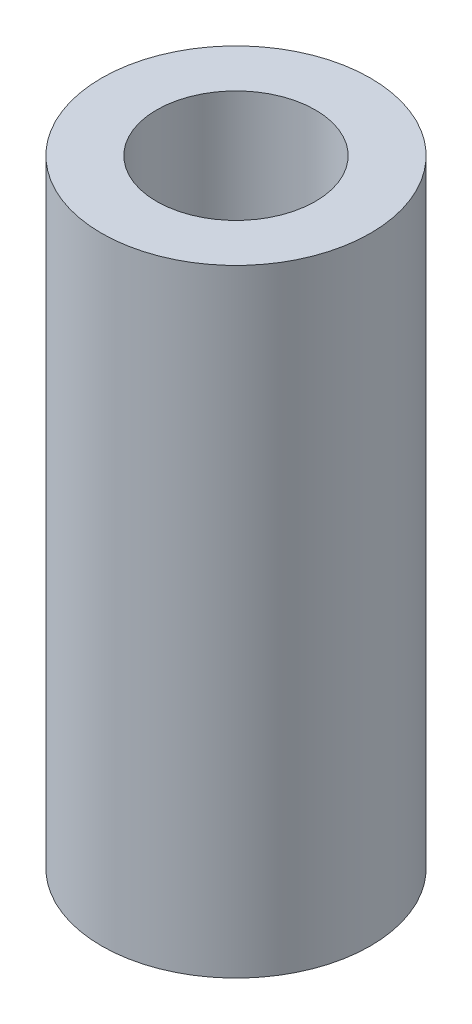
from build123d import *

# Parameters (mm, degrees)
CROQUIS_BASE_R          = 1.525
CROQUIS_BASE_R_2        = 0.9
SALIENTE_EXTRUIR1_DEPTH = 7


with BuildPart() as part:
    # Croquis base → Saliente-Extruir1 (new body)
    with BuildSketch(Plane(origin=(0, 0, 0), x_dir=(1, 0, 0), z_dir=(0, 1, 0))):
        with Locations(Location((0, 0, 0), (0, 0, 270))):
            Circle(CROQUIS_BASE_R)
        with Locations(Location((0, 0, 0), (0, 0, 270))):
            Circle(CROQUIS_BASE_R_2, mode=Mode.SUBTRACT)
    extrude(amount=SALIENTE_EXTRUIR1_DEPTH)


solid = part.part
